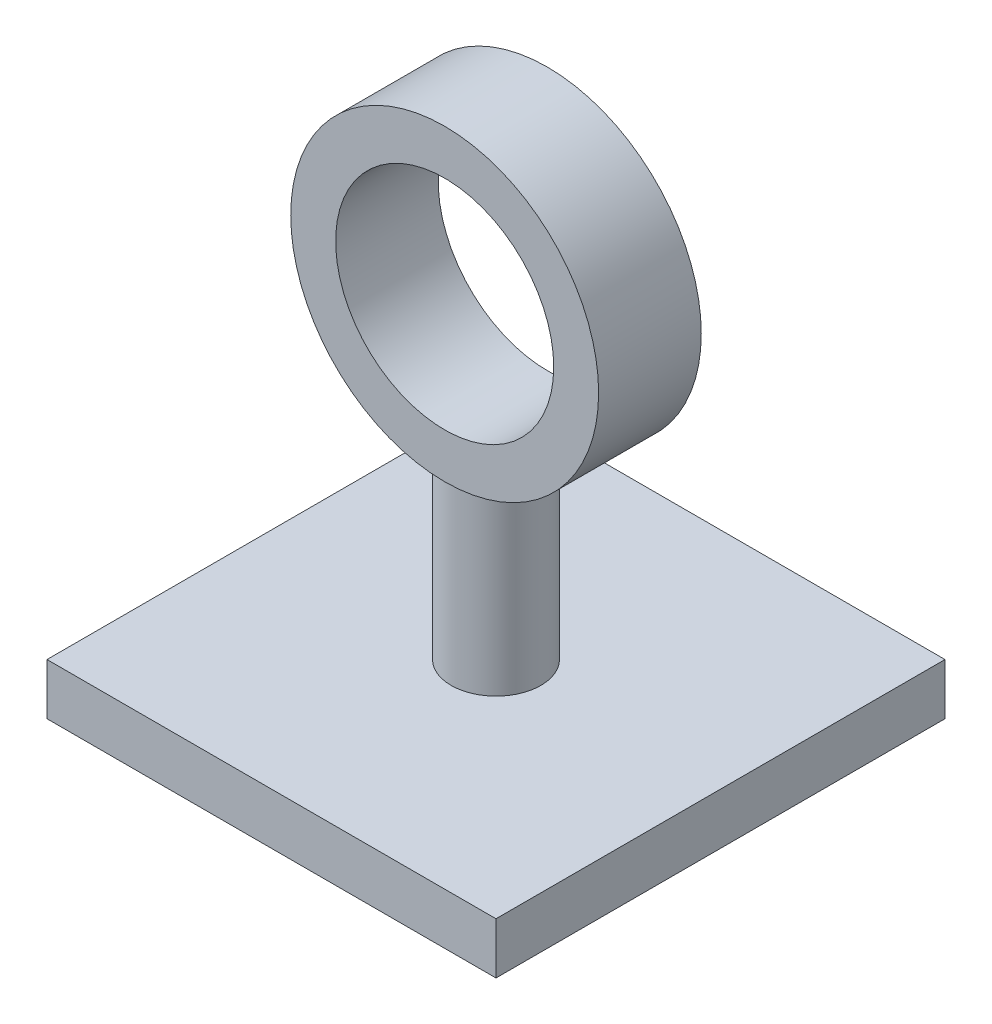
from build123d import *

# Parameters (mm, degrees)
SKETCH1_W                = 70
SKETCH1_H                = 70
BOSS_EXTRUDE1_DEPTH      = 8
SKETCH2_R                = 7
BOSS_EXTRUDE2_DEPTH      = 36
BOSS_EXTRUDE3_DEPTH      = 8
BOSS_EXTRUDE3_DEPTH_BACK = 8
SKETCH3_R                = 24
SKETCH3_R_2              = 17


with BuildPart() as part:
    # Sketch1 → Boss-Extrude1 (new body)
    with BuildSketch(Plane(origin=(0, 0, 0), x_dir=(1, 0, 0), z_dir=(0, 1, 0))):
        Rectangle(SKETCH1_W, SKETCH1_H)
    extrude(amount=BOSS_EXTRUDE1_DEPTH)

    # Sketch2 → Boss-Extrude2 (add)
    with BuildSketch(Plane(origin=(0, 0, 0), x_dir=(1, 0, 0), z_dir=(0, 1, 0))):
        with Locations(Location((0, 0, 0), (0, 0, 270))):
            Circle(SKETCH2_R)
    extrude(amount=BOSS_EXTRUDE2_DEPTH)


with BuildPart() as body_2:
    # Sketch3 → Boss-Extrude3 (new, two sides: drawn at the far end of the back side and taken through both)
    with BuildSketch(Plane.XY.offset(-BOSS_EXTRUDE3_DEPTH_BACK)):
        with Locations((0, 60)):
            Circle(SKETCH3_R)
        with Locations((0, 60)):
            Circle(SKETCH3_R_2, mode=Mode.SUBTRACT)
    extrude(amount=BOSS_EXTRUDE3_DEPTH + BOSS_EXTRUDE3_DEPTH_BACK)


solid = Compound([part.part, body_2.part])
